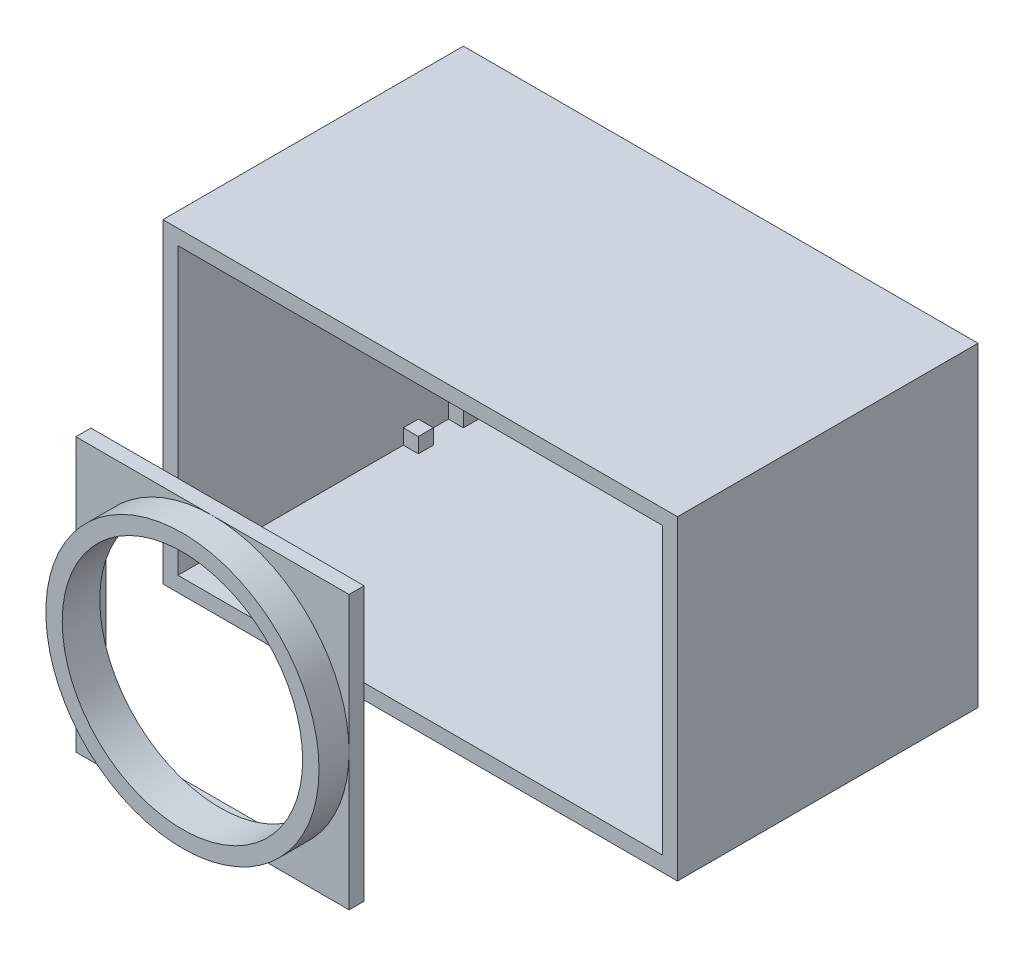
from build123d import *

# Parameters (mm, degrees)
SKETCH1_W           = 434.975
SKETCH1_H           = 266.7
SKETCH1_W_2         = 409.575
SKETCH1_H_2         = 241.3
BOSS_EXTRUDE1_DEPTH = 203.2
SKETCH2_R           = 115.451312682
SKETCH2_R_2         = 101.6
BOSS_EXTRUDE3_DEPTH = 25.4
SKETCH4_W           = 230.902625364
SKETCH4_H           = 230.902625364
SKETCH4_R           = 101.6
BOSS_EXTRUDE4_DEPTH = 12.7
SKETCH8_W           = 205.502625364
SKETCH8_H           = 205.502625364
CUT_EXTRUDE1_DEPTH  = 6.35
SKETCH10_W          = 12.7
SKETCH10_H          = 12.7
BOSS_EXTRUDE5_DEPTH = 12.7
SKETCH1_2_W         = 434.975
SKETCH1_2_H         = 266.7
SKETCH1_2_W_2       = 409.575
SKETCH1_2_H_2       = 241.3
BOSS_EXTRUDE6_DEPTH = 50.8
LPATTERN1_COUNT     = 2
LPATTERN1_PITCH     = 38.1


with BuildPart() as part:
    # Sketch1 → Boss-Extrude1 (new body)
    with BuildSketch(Plane.XY):
        with Locations((217.4875, 133.35)):
            Rectangle(SKETCH1_W, SKETCH1_H)
        with Locations((217.4875, 133.35)):
            Rectangle(SKETCH1_W_2, SKETCH1_H_2, mode=Mode.SUBTRACT)
    extrude(amount=BOSS_EXTRUDE1_DEPTH)

    # Sketch10 → Boss-Extrude5 (add)
    with BuildSketch(Plane.XY):
        with Locations((415.925, 247.65)):
            Rectangle(SKETCH10_W, SKETCH10_H)
        with Locations((19.05, 247.65)):
            Rectangle(SKETCH10_W, SKETCH10_H)
        with Locations((19.05, 19.05)):
            Rectangle(SKETCH10_W, SKETCH10_H)
        with Locations((415.925, 19.05)):
            Rectangle(SKETCH10_W, SKETCH10_H)
    boss_extrude5 = extrude(amount=BOSS_EXTRUDE5_DEPTH)

    # Sketch1<2> → Boss-Extrude6 (add)
    with BuildSketch(Plane.XY):
        with Locations((217.4875, 133.35)):
            Rectangle(SKETCH1_2_W, SKETCH1_2_H)
        with Locations((217.4875, 133.35)):
            Rectangle(SKETCH1_2_W_2, SKETCH1_2_H_2, mode=Mode.SUBTRACT)
    extrude(amount=-BOSS_EXTRUDE6_DEPTH)

    # LPattern1: Boss-Extrude5 ×2
    with Locations(*[(0, 0, -i * LPATTERN1_PITCH) for i in range(1, LPATTERN1_COUNT)]):
        add(boss_extrude5)


with BuildPart() as body_2:
    # Sketch2 → Boss-Extrude3 (new body)
    with BuildSketch(Plane.XY.offset(381)):
        with Locations((219.71, 133.35)):
            Circle(SKETCH2_R)
        with Locations((219.71, 133.35)):
            Circle(SKETCH2_R_2, mode=Mode.SUBTRACT)
    extrude(amount=BOSS_EXTRUDE3_DEPTH)

    # Sketch4 → Boss-Extrude4 (add)
    with BuildSketch(Plane.XY.offset(381)):
        with Locations((219.71, 133.35)):
            Rectangle(SKETCH4_W, SKETCH4_H)
        with Locations((219.71, 133.35)):
            Circle(SKETCH4_R, mode=Mode.SUBTRACT)
    extrude(amount=-BOSS_EXTRUDE4_DEPTH)

    # Sketch8 → Cut-Extrude1 (cut)
    with BuildSketch(Plane(origin=(0, 0, 368.3), x_dir=(-1, 0, 0), z_dir=(0, 0, -1))):
        with Locations((-219.71, 133.35)):
            Rectangle(SKETCH8_W, SKETCH8_H)
    extrude(amount=-CUT_EXTRUDE1_DEPTH, mode=Mode.SUBTRACT)


solid = Compound([part.part, body_2.part])
